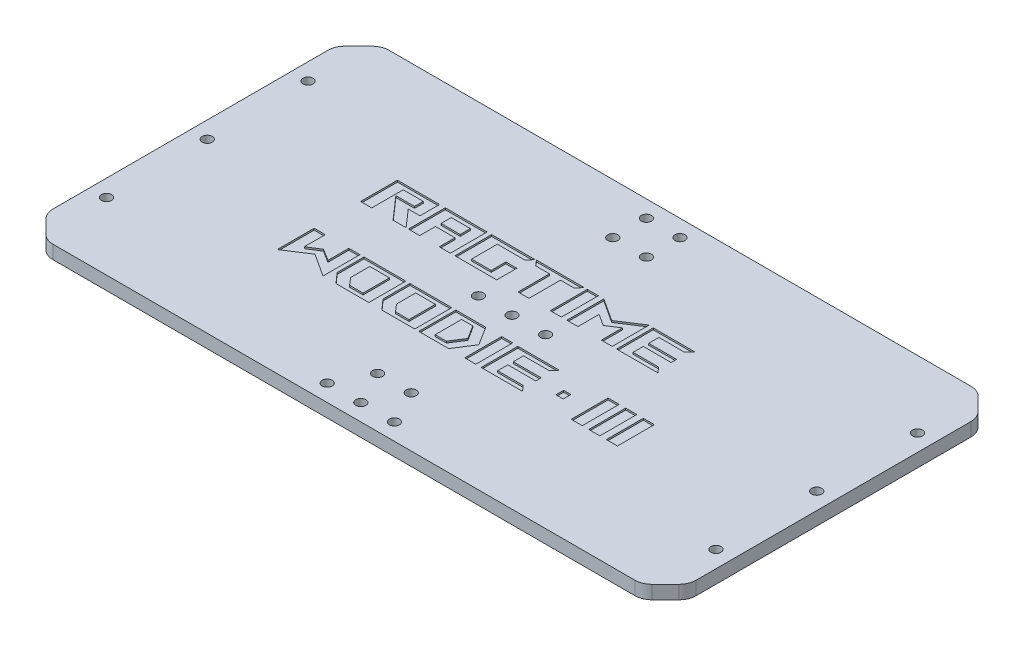
from build123d import *

# Parameters (mm, degrees)
EXTRUDE_1_DEPTH     = 4
SKETCH_3_R          = 1.5
CUT_EXTRUDE_1_DEPTH = 109.048553901
SKETCH_4_W          = 5.682086103
SKETCH_4_H          = 3.033856928
SKETCH_4_W_2        = 3.297277862
SKETCH_4_H_2        = 11
SKETCH_4_W_3        = 2.161852364
SKETCH_4_H_3        = 2.307184611
CUT_EXTRUDE_2_DEPTH = 0.5


with BuildPart() as part:
    # 草图2 → 凸台-拉伸1 (new body)
    with BuildSketch(Plane(origin=(0, 0, 0), x_dir=(1, 0, 0), z_dir=(0, 1, 0))):
        with BuildLine():
            Line((-94.235533906, 44.464466094), (-90.164466094, 48.535533906))
            ThreePointArc((-90.164466094, 48.535533906), (-88.54234935, 49.619397663), (-86.628932188, 50))
            Line((-86.628932188, 50), (86.628932188, 50))
            ThreePointArc((86.628932188, 50), (88.54234935, 49.619397663), (90.164466094, 48.535533906))
            Line((90.164466094, 48.535533906), (94.235533906, 44.464466094))
            ThreePointArc((94.235533906, 44.464466094), (95.319397663, 42.84234935), (95.7, 40.928932188))
            Line((95.7, 40.928932188), (95.7, -40.928932188))
            ThreePointArc((95.7, -40.928932188), (95.319397663, -42.84234935), (94.235533906, -44.464466094))
            Line((94.235533906, -44.464466094), (90.164466094, -48.535533906))
            ThreePointArc((90.164466094, -48.535533906), (88.54234935, -49.619397663), (86.628932188, -50))
            Line((86.628932188, -50), (-86.628932188, -50))
            ThreePointArc((-86.628932188, -50), (-88.54234935, -49.619397663), (-90.164466094, -48.535533906))
            Line((-90.164466094, -48.535533906), (-94.235533906, -44.464466094))
            ThreePointArc((-94.235533906, -44.464466094), (-95.319397663, -42.84234935), (-95.7, -40.928932188))
            Line((-95.7, -40.928932188), (-95.7, 40.928932188))
            ThreePointArc((-95.7, 40.928932188), (-95.319397663, 42.84234935), (-94.235533906, 44.464466094))
        make_face()
    extrude(amount=EXTRUDE_1_DEPTH)

    # 草图3 → 切除-拉伸1 (cut, through all)
    with BuildSketch(Plane.XZ):
        with Locations(Location((5, -45, 0), (0, 0, 270))):
            Circle(SKETCH_3_R)
        with Locations(Location((-5, -45, 0), (0, 0, 270))):
            Circle(SKETCH_3_R)
        with Locations(Location((-5, 35, 0), (0, 0, 90))):
            Circle(SKETCH_3_R)
        with Locations(Location((5, 35, 0), (0, 0, 90))):
            Circle(SKETCH_3_R)
        with Locations(Location((0, 0, 0), (0, 0, 270))):
            Circle(SKETCH_3_R)
        with Locations(Location((10, 0, 0), (0, 0, 270))):
            Circle(SKETCH_3_R)
        with Locations(Location((-10, 0, 0), (0, 0, 270))):
            Circle(SKETCH_3_R)
        with Locations(Location((-5, -35, 0), (0, 0, 270))):
            Circle(SKETCH_3_R)
        with Locations(Location((5, -35, 0), (0, 0, 270))):
            Circle(SKETCH_3_R)
        with Locations(Location((-90.7, 0, 0), (0, 0, 270))):
            Circle(SKETCH_3_R)
        with Locations(Location((-90.7, 30, 0), (0, 0, 270))):
            Circle(SKETCH_3_R)
        with Locations(Location((-90.7, -30, 0), (0, 0, 90))):
            Circle(SKETCH_3_R)
        with Locations(Location((90.7, -30, 0), (0, 0, 270))):
            Circle(SKETCH_3_R)
        with Locations(Location((90.7, 0, 0), (0, 0, 90))):
            Circle(SKETCH_3_R)
        with Locations(Location((90.7, 30, 0), (0, 0, 90))):
            Circle(SKETCH_3_R)
        with Locations(Location((0, 45, 0), (0, 0, 270))):
            Circle(SKETCH_3_R)
        with Locations(Location((10, 45, 0), (0, 0, 270))):
            Circle(SKETCH_3_R)
        with Locations(Location((-10, 45, 0), (0, 0, 270))):
            Circle(SKETCH_3_R)
    extrude(amount=-CUT_EXTRUDE_1_DEPTH, mode=Mode.SUBTRACT)

    # 草图4 → 切除-拉伸2 (cut)
    # profile 1 of 17: a face of its own
    with BuildSketch(Plane(origin=(0, 4, 0), x_dir=(1, 0, 0), z_dir=(0, 1, 0))):
        Polygon((-38.32085157, 6.800845702), (-42.197855071, 6.800845702), (-48.11538673, 13.550284995), (-42.558871591, 13.550284995), (-42.558871591, 16.14814075), (-48.533225531, 16.14814075), (-48.533225531, 6.800845702), (-51.860856066, 6.800845702), (-51.860856066, 17.764866907), (-39.325419279, 17.764866907), (-39.325419279, 11.933558839), (-42.810013519, 11.933558839), align=None)
    # profile 2 of 17: a face of its own
    with BuildSketch(Plane(origin=(0, 4, 0), x_dir=(1, 0, 0), z_dir=(0, 1, 0))):
        Polygon((-25.161383156, 17.764866907), (-25.161383156, 6.804342901), (-28.45762095, 6.804342901), (-28.45762095, 11.481861295), (-34.265278016, 11.481861295), (-34.265278016, 6.804342901), (-37.624301292, 6.804342901), (-37.624301292, 17.764866907), align=None)
        with Locations((-31.377145854, 14.631212286)):
            Rectangle(SKETCH_4_W, SKETCH_4_H, mode=Mode.SUBTRACT)
    # profile 3 of 17: a face of its own
    with BuildSketch(Plane(origin=(0, 4, 0), x_dir=(1, 0, 0), z_dir=(0, 1, 0))):
        Polygon((-11.394127239, 12.823614894), (-11.394127239, 6.843297754), (-23.82636671, 6.843297754), (-23.82636671, 17.764866907), (-10.909768471, 17.764866907), (-12.298857338, 16.14814075), (-20.503823413, 16.14814075), (-20.503823413, 8.46002391), (-14.654275356, 8.46002391), (-14.654275356, 12.823614894), align=None)
    # profile 4 of 17: a face of its own
    with BuildSketch(Plane(origin=(0, 4, 0), x_dir=(1, 0, 0), z_dir=(0, 1, 0))):
        Polygon((2.228971776, 16.259853757), (-1.828347052, 16.259853757), (-1.828347052, 6.878529208), (-5.102399696, 6.878529208), (-5.102399696, 16.259853757), (-9.206714495, 16.259853757), (-10.6009283, 17.878529208), (3.623677894, 17.878529208), align=None)
    # profile 5 of 17: a face of its own
    with BuildSketch(Plane(origin=(0, 4, 0), x_dir=(1, 0, 0), z_dir=(0, 1, 0))):
        with Locations((6.176117739, 12.378529208)):
            Rectangle(SKETCH_4_W_2, SKETCH_4_H_2)
    # profile 6 of 17: a face of its own
    with BuildSketch(Plane(origin=(0, 4, 0), x_dir=(1, 0, 0), z_dir=(0, 1, 0))):
        Polygon((9.455225466, 6.878529208), (9.455225466, 17.878529208), (16.20411257, 13.478456027), (22.95316156, 17.878529208), (22.95316156, 6.878529208), (19.711654823, 6.878529208), (19.711654823, 13.179887909), (16.20411257, 10.94848408), (12.727887658, 13.179887909), (12.727887658, 6.878529208), align=None)
    # profile 7 of 17: a face of its own
    with BuildSketch(Plane(origin=(0, 4, 0), x_dir=(1, 0, 0), z_dir=(0, 1, 0))):
        Polygon((35.171082816, 8.463580985), (36.58355657, 6.846854829), (24.279340759, 6.846854829), (24.279340759, 17.764866907), (36.614603361, 17.764866907), (35.218165275, 16.14814075), (27.575112851, 16.14814075), (27.575112851, 13.114283822), (35.877319693, 13.114283822), (35.877319693, 11.497440131), (27.575112851, 11.497440131), (27.575112851, 8.463580985), align=None)
    # profile 8 of 17: a face of its own
    with BuildSketch(Plane(origin=(0, 4, 0), x_dir=(1, 0, 0), z_dir=(0, 1, 0))):
        Polygon((-38.242057032, -7.014951066), (-38.242057032, -18.014951066), (-45.054281807, -13.583571631), (-51.866506582, -18.014951066), (-51.866506582, -7.014951066), (-48.570268788, -7.014951066), (-48.570268788, -13.25357529), (-45.054281807, -11.037885573), (-41.538294827, -13.25357529), (-41.538294827, -7.014951066), align=None)
    # profile 9 of 17: a face of its own
    with BuildSketch(Plane(origin=(0, 4, 0), x_dir=(1, 0, 0), z_dir=(0, 1, 0))):
        Polygon((-24.584830942, -18.028576172), (-24.584830942, -7.00132596), (-37.038177796, -7.00132596), (-37.038177796, -15.015032715), (-34.356222937, -18.028576172), align=None)
        Polygon((-27.882108804, -8.58184047), (-27.882108804, -16.44806388), (-31.886754533, -16.44806388), (-33.740899935, -14.298517133), (-33.740899935, -8.58184047), align=None, mode=Mode.SUBTRACT)
    # profile 10 of 17: a face of its own
    with BuildSketch(Plane(origin=(0, 4, 0), x_dir=(1, 0, 0), z_dir=(0, 1, 0))):
        Polygon((-10.923391359, -18.028576172), (-10.923391359, -7.00132596), (-23.376738213, -7.00132596), (-23.376738213, -15.015032715), (-20.694783354, -18.028576172), align=None)
        Polygon((-14.220669221, -8.58184047), (-14.220669221, -16.44806388), (-18.22531495, -16.44806388), (-20.079460351, -14.298517133), (-20.079460351, -8.58184047), align=None, mode=Mode.SUBTRACT)
    # profile 11 of 17: a face of its own
    with BuildSketch(Plane(origin=(0, 4, 0), x_dir=(1, 0, 0), z_dir=(0, 1, 0))):
        Polygon((-9.71529863, -7.00132596), (-9.71529863, -18.028576172), (-0.814416518, -18.028576172), (2.670177722, -12.53111203), (-0.814416518, -7.00132596), align=None)
        Polygon((-6.418020768, -8.58184047), (-3.090390233, -8.58184047), (-0.578970961, -12.53111203), (-3.090390233, -16.44806388), (-6.418020768, -16.44806388), align=None, mode=Mode.SUBTRACT)
    # profile 12 of 17: a face of its own
    with BuildSketch(Plane(origin=(0, 4, 0), x_dir=(1, 0, 0), z_dir=(0, 1, 0))):
        with Locations((5.594779884, -12.514951066)):
            Rectangle(SKETCH_4_W_2, SKETCH_4_H_2)
    # profile 13 of 17: a face of its own
    with BuildSketch(Plane(origin=(0, 4, 0), x_dir=(1, 0, 0), z_dir=(0, 1, 0))):
        Polygon((19.765629669, -16.42989929), (21.178103423, -18.046625446), (8.873887612, -18.046625446), (8.873887612, -7.128613368), (21.209150214, -7.128613368), (19.812712128, -8.745339524), (12.169659704, -8.745339524), (12.169659704, -11.779196453), (20.471866546, -11.779196453), (20.471866546, -13.396040143), (12.169659704, -13.396040143), (12.169659704, -16.42989929), align=None)
    # profile 14 of 17: a face of its own
    with BuildSketch(Plane(origin=(0, 4, 0), x_dir=(1, 0, 0), z_dir=(0, 1, 0))):
        with Locations((28.12162175, -12.805621103)):
            Rectangle(SKETCH_4_W_3, SKETCH_4_H_3)
    # profile 15 of 17: a face of its own
    with BuildSketch(Plane(origin=(0, 4, 0), x_dir=(1, 0, 0), z_dir=(0, 1, 0))):
        with Locations((37.27769296, -12.514951066)):
            Rectangle(SKETCH_4_W_2, SKETCH_4_H_2)
    # profile 16 of 17: a face of its own
    with BuildSketch(Plane(origin=(0, 4, 0), x_dir=(1, 0, 0), z_dir=(0, 1, 0))):
        with Locations((42.509733652, -12.514951066)):
            Rectangle(SKETCH_4_W_2, SKETCH_4_H_2)
    # profile 17 of 17: a face of its own
    with BuildSketch(Plane(origin=(0, 4, 0), x_dir=(1, 0, 0), z_dir=(0, 1, 0))):
        with Locations((47.741774343, -12.514951066)):
            Rectangle(SKETCH_4_W_2, SKETCH_4_H_2)
    extrude(amount=-CUT_EXTRUDE_2_DEPTH, mode=Mode.SUBTRACT)


solid = part.part
